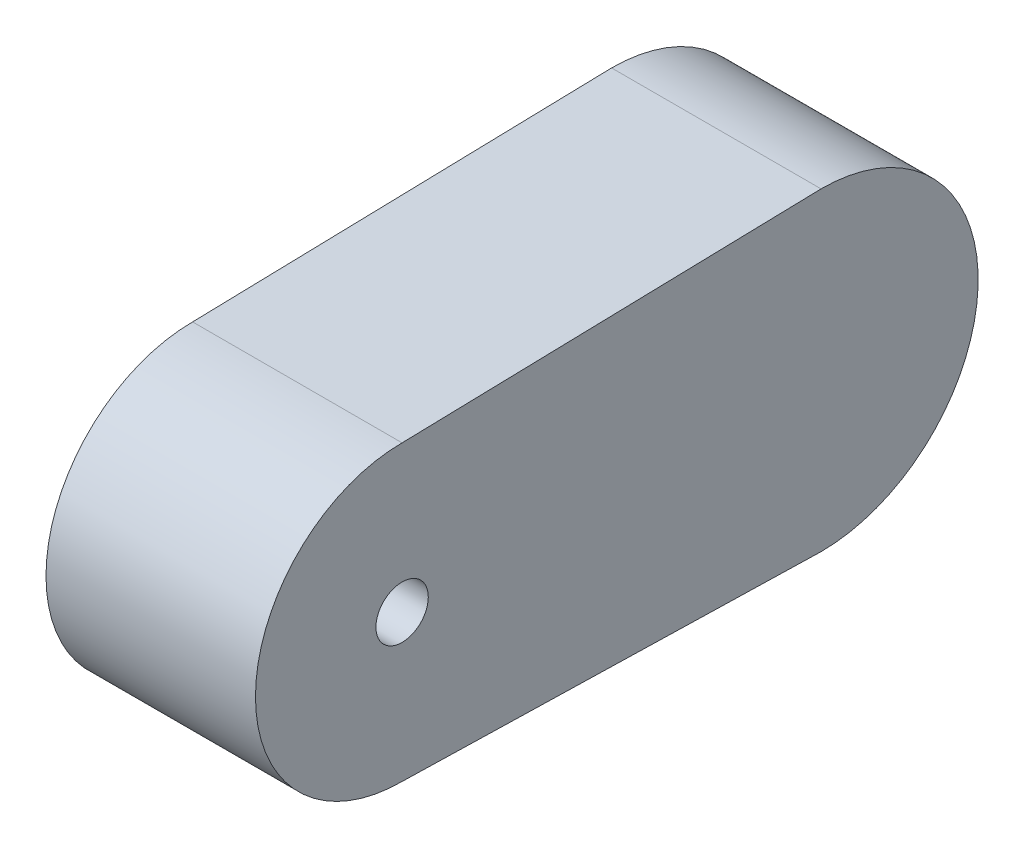
from build123d import *

# Parameters (mm, degrees)
CROQUIS1_R              = 2.5
SALIENTE_EXTRUIR1_DEPTH = 10


with BuildPart() as part:
    # Croquis1 → Saliente-Extruir1 (new, symmetric)
    with BuildSketch(Plane(origin=(0, 0, 0), x_dir=(0, 0, -1), z_dir=(1, 0, 0))):
        with BuildLine():
            Line((0, 14), (40, 15))
            ThreePointArc((40, 15), (55, 0), (40, -15))
            Line((40, -15), (0, -14))
            ThreePointArc((0, -14), (-14, 0), (0, 14))
        make_face()
        Circle(CROQUIS1_R, mode=Mode.SUBTRACT)
    extrude(amount=SALIENTE_EXTRUIR1_DEPTH, both=True)


solid = part.part
